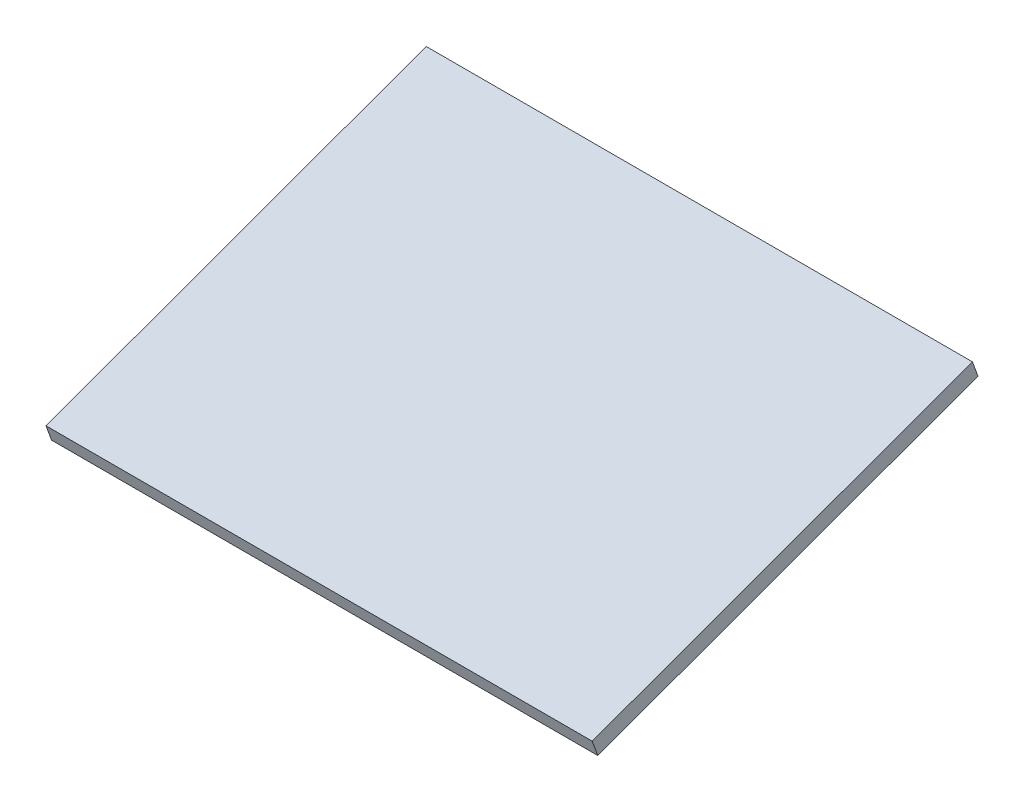
from build123d import *

# Parameters (mm, degrees)
BOSS_EXTRUDE1_DEPTH = 54


with BuildPart() as part:
    # Sketch1 → Boss-Extrude1 (new body)
    with BuildSketch(Plane(origin=(-27, 0, 0), x_dir=(0, 0, -1), z_dir=(1, 0, 0))):
        Polygon((10.3015, 232.7899), (-27.2862, 219.1091), (-27.8334, 220.6126), (9.7543, 234.2934), align=None)
    extrude(amount=BOSS_EXTRUDE1_DEPTH)


solid = part.part
